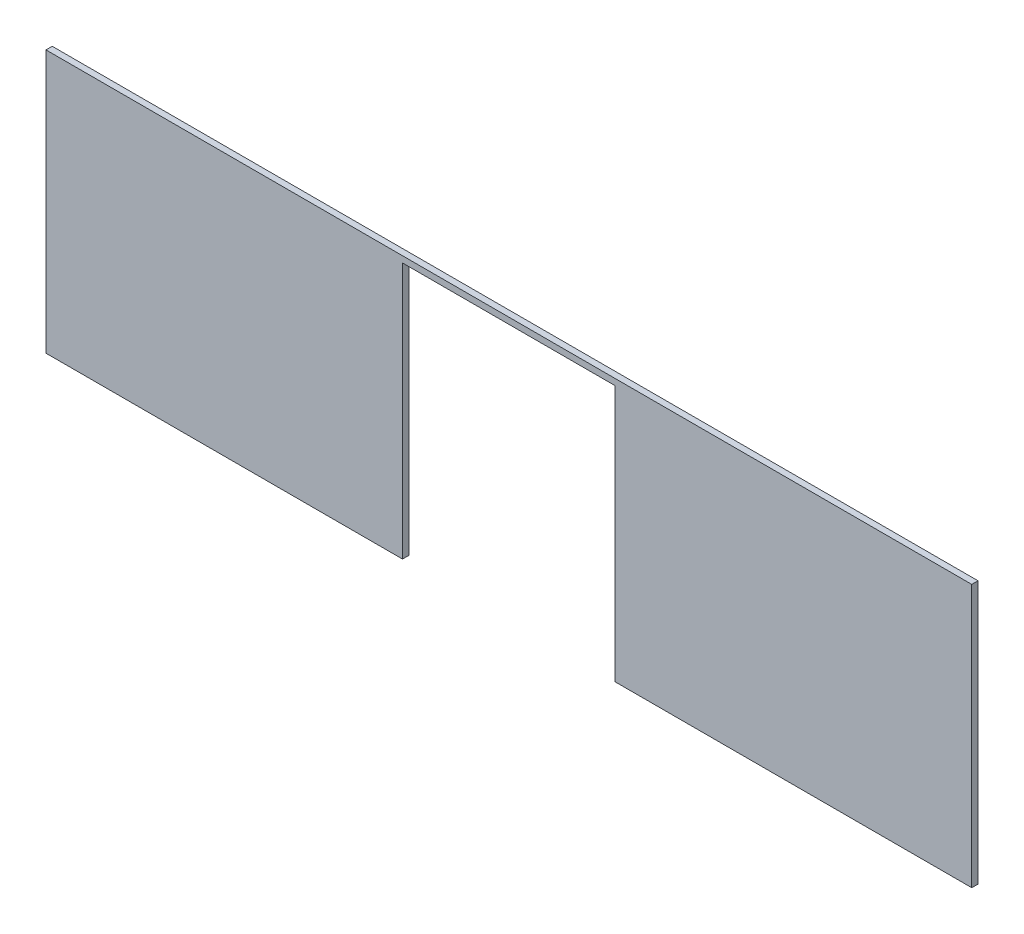
from build123d import *

# Parameters (mm, degrees)
SKETCH1_W           = 469.9
SKETCH1_H           = 133.35
BOSS_EXTRUDE1_DEPTH = 3.175
SKETCH2_W           = 107.95
SKETCH2_H           = 130.175
CUT_EXTRUDE1_DEPTH  = 3.175


with BuildPart() as part:
    # Sketch1 → Boss-Extrude1 (new body)
    with BuildSketch(Plane.XY):
        Rectangle(SKETCH1_W, SKETCH1_H)
    extrude(amount=BOSS_EXTRUDE1_DEPTH)

    # Sketch2 → Cut-Extrude1 (cut)
    with BuildSketch(Plane.XY.offset(3.175)):
        with Locations((0, -1.5875)):
            Rectangle(SKETCH2_W, SKETCH2_H)
    extrude(amount=-CUT_EXTRUDE1_DEPTH, mode=Mode.SUBTRACT)


solid = part.part
